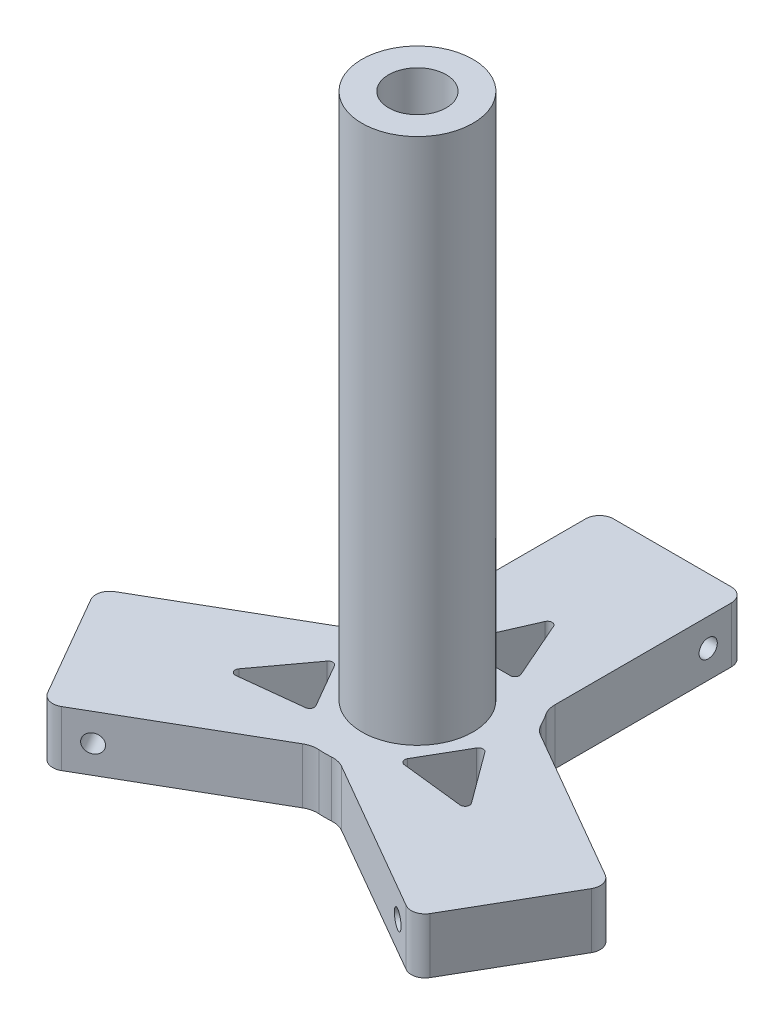
from build123d import *

# Parameters (mm, degrees)
BOSS_EXTRUDE1_DEPTH      = 7.62
M3X0_5_TAPPED_HOLE2_D    = 2.5
M3X0_5_TAPPED_HOLE3_D    = 2.5
M3X0_5_TAPPED_HOLE4_D    = 2.5
FILLET1_R                = 3.175
SKETCH10_R               = 7.62
CUT_EXTRUDE1_DEPTH       = 51.298342829
CUT_EXTRUDE2_DEPTH       = 51.298342829
FILLET2_R                = 0.635
CIRPATTERN1_COUNT        = 2
CIRPATTERN1_ANGLE        = 120
FILLET2_OF_CIRPATTERN1_R = 0.635
CIRPATTERN5_COUNT        = 2
CIRPATTERN5_ANGLE        = 240
FILLET2_OF_CIRPATTERN5_R = 0.635
FILLET3_R                = 1.905
SKETCH12_R               = 7.62
BOSS_EXTRUDE3_DEPTH      = 80
SKETCH14_R               = 3.95
CUT_EXTRUDE3_DEPTH       = 94.931474879


with BuildPart() as part:
    # Sketch1 → Boss-Extrude1 (new body)
    with BuildSketch(Plane(origin=(0, 0, 0), x_dir=(1, 0, 0), z_dir=(0, 1, 0))):
        with BuildLine():
            Line((0, 35), (10, 35))
            Line((10, 35), (10, 7.82879301))
            ThreePointArc((10, 7.82879301), (10.995187387, 6.355773306), (11.774944022, 4.758223752))
            Line((11.774944022, 4.758223752), (35.310889132, -8.839745962))
            Line((35.310889132, -8.839745962), (30.310889132, -17.5))
            Line((30.310889132, -17.5), (25.310889132, -26.160254038))
            Line((25.310889132, -26.160254038), (1.779933628, -12.574650543))
            ThreePointArc((1.779933628, -12.574650543), (0, -12.7), (-1.779933628, -12.574650543))
            Line((-1.779933628, -12.574650543), (-25.310889132, -26.160254038))
            Line((-25.310889132, -26.160254038), (-30.310889132, -17.5))
            Line((-30.310889132, -17.5), (-35.310889132, -8.839745962))
            Line((-35.310889132, -8.839745962), (-11.779933628, 4.745857533))
            ThreePointArc((-11.779933628, 4.745857533), (-10.998522628, 6.35), (-10, 7.82879301))
            Line((-10, 7.82879301), (-10, 35))
            Line((-10, 35), (0, 35))
        make_face()
    extrude(amount=BOSS_EXTRUDE1_DEPTH)

    # M3x0.5 Tapped Hole2 (through all)
    with Locations(Plane(origin=(10, 0, 0), x_dir=(0, 0, -1), z_dir=(1, 0, 0))):
        with Locations((29.92, 3.81)):
            Hole(M3X0_5_TAPPED_HOLE2_D / 2)

    # M3x0.5 Tapped Hole3 (through all)
    with Locations(Plane(origin=(-5, 0, -8.660254038), x_dir=(-0.8660254037844434, 0, 0.499999999999992), z_dir=(-0.499999999999992, 0, -0.8660254037844434))):
        with Locations((29.92, 3.81)):
            Hole(M3X0_5_TAPPED_HOLE3_D / 2)

    # M3x0.5 Tapped Hole4 (through all)
    with Locations(Plane(origin=(-5, 0, 8.660254038), x_dir=(0.8660254037844398, 0, 0.49999999999999795), z_dir=(-0.49999999999999795, 0, 0.8660254037844398))):
        with Locations((29.92, 3.81)):
            Hole(M3X0_5_TAPPED_HOLE4_D / 2)

    # Fillet1
    fillet1_edges = [part.edges().sort_by_distance(p)[0] for p in [
        (10, 3.81, -7.82879301),
        (11.774944022, 3.81, -4.758223752),
        (1.779933628, 3.81, 12.574650543),
        (-1.779933628, 3.81, 12.574650543),
        (-11.779933628, 3.81, -4.745857533),
        (-10, 3.81, -7.82879301),
    ]]
    fillet(fillet1_edges, radius=FILLET1_R)

    # Sketch10 → Cut-Extrude1 (cut, through all)
    with BuildSketch(Plane(origin=(0, 7.62, 0), x_dir=(1, 0, 0), z_dir=(0, 1, 0))):
        with Locations(Location((0, 0, 0), (0, 0, 270))):
            Circle(SKETCH10_R)
    extrude(amount=-CUT_EXTRUDE1_DEPTH, mode=Mode.SUBTRACT)

    # Sketch11 → Cut-Extrude2 (cut, through all)
    with BuildSketch(Plane(origin=(0, 7.62, 0), x_dir=(1, 0, 0), z_dir=(0, 1, 0))):
        Polygon((0, 19.432672172), (-4.445, 9.272672172), (4.445, 9.272672172), align=None)
    cut_extrude2 = extrude(amount=-CUT_EXTRUDE2_DEPTH, mode=Mode.SUBTRACT)

    # Fillet2
    fillet2_edges = [part.edges().sort_by_distance(p)[0] for p in [
        (0, 3.81, -19.432672172),
        (4.445, 3.81, -9.272672172),
        (-4.445, 3.81, -9.272672172),
    ]]
    fillet(fillet2_edges, radius=FILLET2_R)

    # CirPattern1: Cut-Extrude2 ×2 about axis
    cirpattern1_axis = Axis((0, 0, 0), (0, 1, 0))
    for i in range(1, CIRPATTERN1_COUNT):
        add(cut_extrude2.rotate(cirpattern1_axis, i * CIRPATTERN1_ANGLE / (CIRPATTERN1_COUNT - 1)), mode=Mode.SUBTRACT)

    # Fillet2 of CirPattern1
    fillet2_of_cirpattern1_edges = [part.edges().sort_by_distance(p)[0] for p in [
        (-16.829187764, 3.81, 9.716336086),
        (-10.252869662, 3.81, 0.786853166),
        (-5.807869662, 3.81, 8.485819006),
    ]]
    fillet(fillet2_of_cirpattern1_edges, radius=FILLET2_OF_CIRPATTERN1_R)

    # CirPattern5: Cut-Extrude2 ×2 about axis
    cirpattern5_axis = Axis((0, 0, 0), (0, 1, 0))
    for i in range(1, CIRPATTERN5_COUNT):
        add(cut_extrude2.rotate(cirpattern5_axis, i * CIRPATTERN5_ANGLE / (CIRPATTERN5_COUNT - 1)), mode=Mode.SUBTRACT)

    # Fillet2 of CirPattern5
    fillet2_of_cirpattern5_edges = [part.edges().sort_by_distance(p)[0] for p in [
        (16.829187764, 3.81, 9.716336086),
        (5.807869662, 3.81, 8.485819006),
        (10.252869662, 3.81, 0.786853166),
    ]]
    fillet(fillet2_of_cirpattern5_edges, radius=FILLET2_OF_CIRPATTERN5_R)

    # Fillet3
    fillet3_edges = [part.edges().sort_by_distance(p)[0] for p in [
        (10, 3.81, -35),
        (35.310889132, 3.81, 8.839745962),
        (25.310889132, 3.81, 26.160254038),
        (-25.310889132, 3.81, 26.160254038),
        (-35.310889132, 3.81, 8.839745962),
        (-10, 3.81, -35),
    ]]
    fillet(fillet3_edges, radius=FILLET3_R)


with BuildPart() as body_2:
    # Sketch12 → Boss-Extrude3 (new body)
    with BuildSketch(Plane.XZ):
        with Locations(Location((0, 0, 0), (0, 0, 270))):
            Circle(SKETCH12_R)
    extrude(amount=-BOSS_EXTRUDE3_DEPTH)

    # Sketch14 → Cut-Extrude3 (cut, through all)
    with BuildSketch(Plane.XZ):
        with Locations(Location((0, 0, 0), (0, 0, 270))):
            Circle(SKETCH14_R)
    extrude(amount=-CUT_EXTRUDE3_DEPTH, mode=Mode.SUBTRACT)


solid = Compound([part.part, body_2.part])
